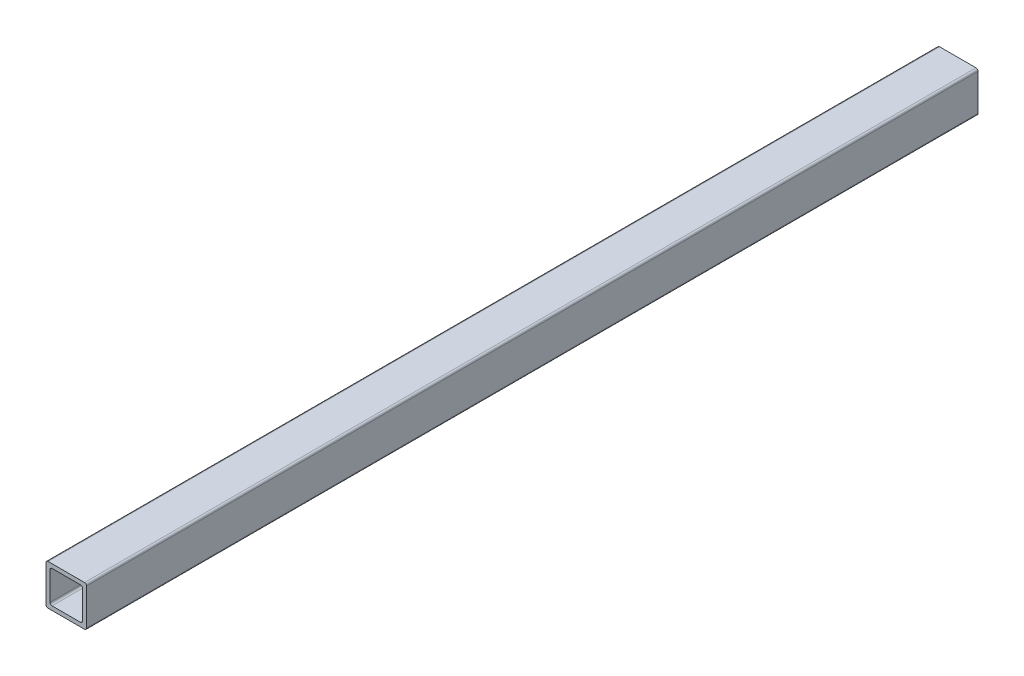
from build123d import *

# Parameters (mm, degrees)
BOSS_EXTRU_1_DEPTH = 880


with BuildPart() as part:
    # Esquisse2 → Boss.-Extru.1 (new body)
    with BuildSketch(Plane.XY):
        with BuildLine():
            Line((2, 0), (38, 0))
            ThreePointArc((38, 0), (39.414213562, 0.585786438), (40, 2))
            Line((40, 2), (40, 38))
            ThreePointArc((40, 38), (39.414213562, 39.414213562), (38, 40))
            Line((38, 40), (2, 40))
            ThreePointArc((2, 40), (0.585786438, 39.414213562), (0, 38))
            Line((0, 38), (0, 2))
            ThreePointArc((0, 2), (0.585786438, 0.585786438), (2, 0))
        make_face()
        with BuildLine():
            Line((6, 4), (34, 4))
            ThreePointArc((34, 4), (35.414213562, 4.585786438), (36, 6))
            Line((36, 6), (36, 34))
            ThreePointArc((36, 34), (35.414213562, 35.414213562), (34, 36))
            Line((34, 36), (6, 36))
            ThreePointArc((6, 36), (4.585786438, 35.414213562), (4, 34))
            Line((4, 34), (4, 6))
            ThreePointArc((4, 6), (4.585786438, 4.585786438), (6, 4))
        make_face(mode=Mode.SUBTRACT)
    extrude(amount=BOSS_EXTRU_1_DEPTH)


solid = part.part
